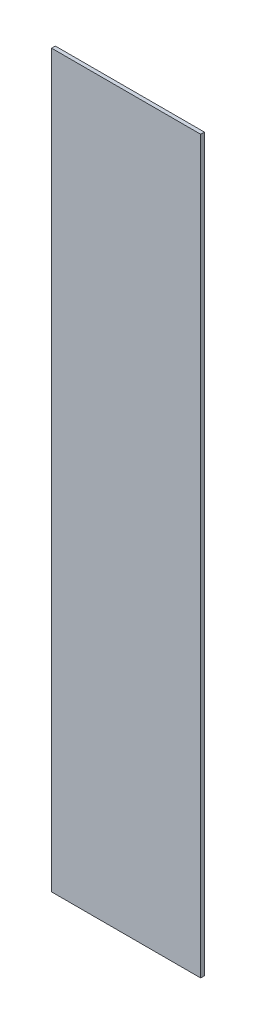
from build123d import *

# Parameters (mm, degrees)
SKETCH_1_W      = 20
SKETCH_1_H      = 98
EXTRUDE_1_DEPTH = 0.5


with BuildPart() as part:
    # 草图1 → 凸台-拉伸1 (new body)
    with BuildSketch(Plane.XY):
        Rectangle(SKETCH_1_W, SKETCH_1_H)
    extrude(amount=EXTRUDE_1_DEPTH)


solid = part.part
